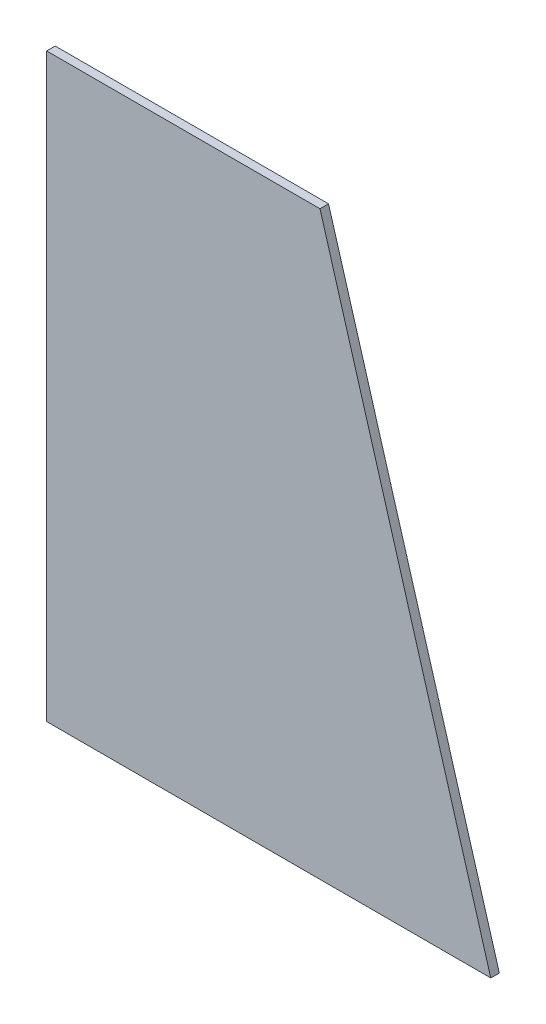
from build123d import *

# Parameters (mm, degrees)
BOSS_EXTRUDE1_DEPTH = 3.175


with BuildPart() as part:
    # Sketch1 → Boss-Extrude1 (new body)
    with BuildSketch(Plane.XY):
        Polygon((0, 107.95), (101.6, 107.95), (165.1, -107.95), (0, -107.95), align=None)
    extrude(amount=-BOSS_EXTRUDE1_DEPTH)


solid = part.part
